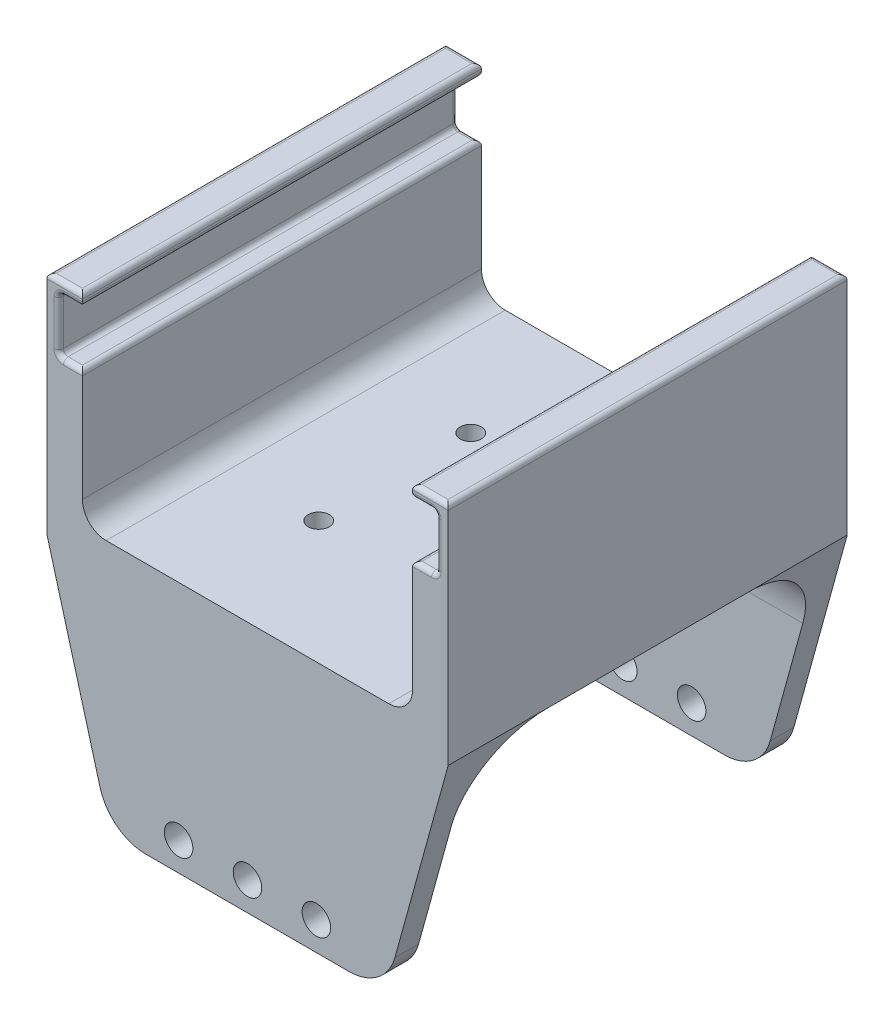
from build123d import *

# Parameters (mm, degrees)
SKETCH4_W               = 84.5
SKETCH4_H               = 84
BOSS_EXTRUDE1_DEPTH     = 5
SKETCH5_W               = 84.5
SKETCH5_H               = 5
BOSS_EXTRUDE2_DEPTH     = 48
SKETCH6_R               = 2.225
CUT_EXTRUDE1_DEPTH      = 48
SKETCH7_W               = 7.5
SKETCH7_H               = 84
BOSS_EXTRUDE3_DEPTH     = 28.5
SKETCH8_W               = 2.5
SKETCH8_H               = 84
BOSS_EXTRUDE4_DEPTH     = 11.5
CUT_EXTRUDE2_DEPTH      = 93
CUT_EXTRUDE2_DEPTH_BACK = 5
SKETCH9_R               = 3
SKETCH10_W              = 7.5
SKETCH10_H              = 84
BOSS_EXTRUDE5_DEPTH     = 2.5
FILLET1_R               = 1
CUT_EXTRUDE3_DEPTH      = 88
CUT_EXTRUDE3_DEPTH_BACK = 24.5
FILLET2_R               = 10
FILLET3_R               = 5
FILLET4_R               = 15.75


with BuildPart() as part:
    # Sketch4 → Boss-Extrude1 (new body)
    with BuildSketch(Plane(origin=(0, 25, 0), x_dir=(1, 0, 0), z_dir=(0, 1, 0))):
        with Locations((10, 37)):
            Rectangle(SKETCH4_W, SKETCH4_H)
    extrude(amount=BOSS_EXTRUDE1_DEPTH)

    # Sketch5 → Boss-Extrude2 (add)
    with BuildSketch(Plane.XZ.offset(-25)):
        with Locations((10, 2.5)):
            Rectangle(SKETCH5_W, SKETCH5_H)
        with Locations((10, -76.5)):
            Rectangle(SKETCH5_W, SKETCH5_H)
    extrude(amount=BOSS_EXTRUDE2_DEPTH)

    # Sketch6 → Cut-Extrude1 (cut)
    with BuildSketch(Plane.XZ.offset(-25)):
        with Locations(Location((-1, -21, 0), (0, 0, 270))):
            Circle(SKETCH6_R)
        with Locations(Location((-1, -53, 0), (0, 0, 270))):
            Circle(SKETCH6_R)
    extrude(amount=-CUT_EXTRUDE1_DEPTH, mode=Mode.SUBTRACT)

    # Sketch7 → Boss-Extrude3 (add)
    with BuildSketch(Plane(origin=(0, 30, 0), x_dir=(1, 0, 0), z_dir=(0, 1, 0))):
        with Locations((-28.5, 37)):
            Rectangle(SKETCH7_W, SKETCH7_H)
        with Locations((48.5, 37)):
            Rectangle(SKETCH7_W, SKETCH7_H)
    extrude(amount=BOSS_EXTRUDE3_DEPTH)

    # Sketch8 → Boss-Extrude4 (add)
    with BuildSketch(Plane(origin=(0, 58.5, 0), x_dir=(1, 0, 0), z_dir=(0, 1, 0))):
        with Locations((-31, 37)):
            Rectangle(SKETCH8_W, SKETCH8_H)
        with Locations((51, 37)):
            Rectangle(SKETCH8_W, SKETCH8_H)
    extrude(amount=BOSS_EXTRUDE4_DEPTH)

    # Sketch9 → Cut-Extrude2 (cut, two sides: drawn at the far end of the back side and taken through both)
    with BuildSketch(Plane(origin=(0, 0, 0), x_dir=(-1, 0, 0), z_dir=(0, 0, -1)).offset(-CUT_EXTRUDE2_DEPTH_BACK)):
        with Locations(Location((-10, -17, 0), (0, 0, 270))):
            Circle(SKETCH9_R)
        with Locations(Location((-24.5, -17, 0), (0, 0, 270))):
            Circle(SKETCH9_R)
        with Locations(Location((4.5, -17, 0), (0, 0, 270))):
            Circle(SKETCH9_R)
    extrude(amount=CUT_EXTRUDE2_DEPTH + CUT_EXTRUDE2_DEPTH_BACK, mode=Mode.SUBTRACT)

    # Sketch10 → Boss-Extrude5 (add)
    with BuildSketch(Plane(origin=(0, 70, 0), x_dir=(1, 0, 0), z_dir=(0, 1, 0))):
        with Locations((48.5, 37)):
            Rectangle(SKETCH10_W, SKETCH10_H)
        with Locations((-28.5, 37)):
            Rectangle(SKETCH10_W, SKETCH10_H)
    extrude(amount=BOSS_EXTRUDE5_DEPTH)

    # Fillet1
    fillet1_edges = [part.edges().sort_by_distance(p)[0] for p in [
        (47.25, 70, -79),
        (44.75, 70, -37),
        (47.25, 70, 5),
        (52.25, 72.5, -37),
        (48.5, 72.5, -79),
        (44.75, 72.5, -37),
        (48.5, 72.5, 5),
        (-27.25, 70, 5),
        (-24.75, 70, -37),
        (-27.25, 70, -79),
        (-32.25, 72.5, -37),
        (-28.5, 72.5, 5),
        (-24.75, 72.5, -37),
        (-28.5, 72.5, -79),
        (-24.75, 58.5, -37),
        (-27.25, 58.5, -79),
        (44.75, 58.5, -37),
        (47.25, 58.5, 5),
        (-27.25, 58.5, 5),
        (47.25, 58.5, -79),
        (-29.75, 58.5, -37),
        (-29.75, 64.25, 5),
        (-29.75, 64.25, -79),
        (-29.75, 70, -37),
        (49.75, 58.5, -37),
        (49.75, 64.25, -79),
        (49.75, 64.25, 5),
        (49.75, 70, -37),
    ]]
    fillet(fillet1_edges, radius=FILLET1_R)

    # Sketch11 → Cut-Extrude3 (cut, two sides: drawn at the far end of the back side and taken through both)
    with BuildSketch(Plane(origin=(0, 0, 0), x_dir=(-1, 0, 0), z_dir=(0, 0, -1)).offset(-CUT_EXTRUDE3_DEPTH_BACK)):
        Polygon((19, -23), (32.25, -23), (32.25, 25), align=None)
        Polygon((-39, -23), (-52.25, -23), (-52.25, 25), align=None)
    extrude(amount=CUT_EXTRUDE3_DEPTH + CUT_EXTRUDE3_DEPTH_BACK, mode=Mode.SUBTRACT)

    # Fillet2
    fillet2_edges = [part.edges().sort_by_distance(p)[0] for p in [
        (39, -23, 2.5),
        (-19, -23, 2.5),
        (-19, -23, -76.5),
        (39, -23, -76.5),
    ]]
    fillet(fillet2_edges, radius=FILLET2_R)

    # Fillet3
    fillet3_edges = [part.edges().sort_by_distance(p)[0] for p in [
        (-24.75, 30, -37),
        (44.75, 30, -37),
    ]]
    fillet(fillet3_edges, radius=FILLET3_R)

    # Fillet4
    fillet4_edges = [part.edges().sort_by_distance(p)[0] for p in [
        (10, 25, 0),
        (10, 25, -74),
    ]]
    fillet(fillet4_edges, radius=FILLET4_R)


solid = part.part
